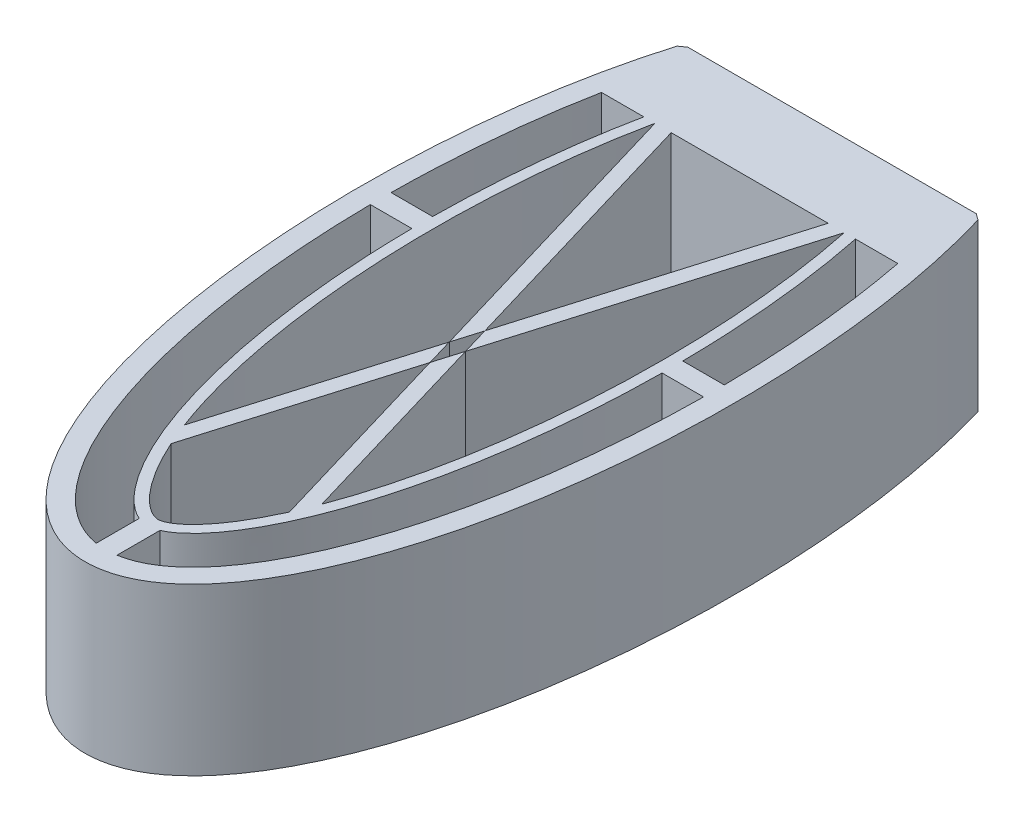
from build123d import *

# Parameters (mm, degrees)
BOSS_EXTRUDE1_DEPTH = 16
BOSS_EXTRUDE2_DEPTH = 16
BOSS_EXTRUDE3_DEPTH = 16
BOSS_EXTRUDE4_DEPTH = 16
SKETCH9_W           = 40
SKETCH9_H           = 24
CUT_EXTRUDE4_DEPTH  = 22
SKETCH10_R          = 1
CUT_EXTRUDE5_DEPTH  = 10
SKETCH25_R          = 1.25
CUT_EXTRUDE12_DEPTH = 4
SKETCH23_R          = 1.25
CUT_EXTRUDE13_DEPTH = 4
SKETCH24_R          = 1.25
CUT_EXTRUDE14_DEPTH = 3


with BuildPart() as part:
    # Sketch1 → Boss-Extrude1 (new body)
    with BuildSketch(Plane(origin=(0, 0, 0), x_dir=(1, 0, 0), z_dir=(0, 1, 0))):
        with BuildLine():
            Line((0, 0), (0, -1.370526213))
            Line((0, -1.370526213), (-4.257744064, -4.437196595))
            add(Edge.make_bspline(
                [(-4.257744064, -4.437196595), (-4.502691757, -5.256633093), (-4.954383697, -6.883392156), (-5.782550999, -10.343670153), (-6.633990879, -14.904009628), (-7.357399252, -20.692157262), (-7.904756341, -28.674189668), (-7.788402639, -38.875434181), (-6.374993684, -50.562842935), (-3.780113753, -60.835361347), (-0.759598491, -67.612587129), (2.128148554, -71.70837272), (4.548190426, -74.065562813), (7.262501719, -75.621626405), (10.25, -76.189186798), (13.237498281, -75.621626405), (15.951809575, -74.065562813), (18.371851447, -71.70837272), (21.259598492, -67.612587128), (24.280113753, -60.835361347), (26.874993684, -50.562842934), (28.28840264, -38.87543418), (28.404756341, -28.674189668), (27.857399252, -20.692157261), (27.133990879, -14.904009627), (26.282550999, -10.343670152), (25.454383697, -6.883392155), (25.002691757, -5.256633093), (24.757744064, -4.437196595)],
                knots=[-2.240685274, -2.240685274, -2.240685274, -2.240685274, -2.17066386, -2.100642445, -1.960599615, -1.820556785, -1.680513956, -1.400428296, -1.120342637, -0.840256978, -0.560171319, -0.420128489, -0.280085659, -0.14004283, 0, 0.14004283, 0.280085659, 0.420128489, 0.560171319, 0.840256978, 1.120342637, 1.400428296, 1.680513956, 1.820556785, 1.960599615, 2.100642445, 2.17066386, 2.240685274, 2.240685274, 2.240685274, 2.240685274], degree=3))
            Line((24.757744064, -4.437196595), (20.5, -1.370526213))
            Line((20.5, -1.370526213), (20.5, 0))
            Line((20.5, 0), (16.5, 0))
            Line((16.5, 0), (16.5, -4))
            Line((16.5, -4), (4, -4))
            Line((4, -4), (4, 0))
            Line((4, 0), (0, 0))
        make_face()
        with BuildLine():
            Line((-2.75, -6.437196595), (23.25, -6.437196595))
            add(Edge.make_bspline(
                [(-2.75, -6.437196595), (-21.25501839, -74), (10.25, -74), (41.75501839, -74), (23.25, -6.437196595)],
                knots=[4.084586939, 4.084586939, 4.084586939, 6.283185307, 6.283185307, 8.481783676, 8.481783676, 8.481783676], degree=2, weights=[1, 0.454220582, 1, 0.454220582, 1]))
        make_face(mode=Mode.SUBTRACT)
    extrude(amount=BOSS_EXTRUDE1_DEPTH)

    # Sketch4 → Boss-Extrude2 (add)
    with BuildSketch(Plane(origin=(0, 16, 0), x_dir=(1, 0, 0), z_dir=(0, 1, 0))):
        with BuildLine():
            Line((24.000704622, -9.437196595), (-3.500704622, -9.437196595))
            add(Edge.make_bspline(
                [(-3.500704622, -9.437196595), (-3.78018184, -10.663685094), (-4.027900282, -11.937196595)],
                knots=[4.169182878, 4.169182878, 4.169182878, 4.236480106, 4.236480106, 4.236480106], degree=2, weights=[1, 0.999433939, 1]))
            Line((-4.027900282, -11.937196595), (-0.970025558, -11.937196595))
            Line((-0.970025558, -11.937196595), (13.964140864, -11.937196595))
            Line((13.964140864, -11.937196595), (15.124869395, -11.937196595))
            Line((15.124869395, -11.937196595), (21.469998047, -11.937196595))
            Line((21.469998047, -11.937196595), (24.527900282, -11.937196595))
            add(Edge.make_bspline(
                [(24.527900282, -11.937196595), (24.28018184, -10.663685094), (24.000704622, -9.437196595)],
                knots=[2.046705202, 2.046705202, 2.046705202, 2.114002429, 2.114002429, 2.114002429], degree=2, weights=[1, 0.999433939, 1]))
        make_face()
    extrude(amount=-BOSS_EXTRUDE2_DEPTH)

    # Sketch5 → Boss-Extrude3 (add)
    with BuildSketch(Plane(origin=(0, 16, 0), x_dir=(1, 0, 0), z_dir=(0, 1, 0))):
        with BuildLine():
            add(Edge.make_bspline(
                [(-1.608424276, -30.437196595), (-1.619611068, -31.103668087), (-1.61967472, -31.770333643), (-1.608424276, -32.437196595)],
                knots=[0.190744117, 0.190744117, 0.190744117, 0.190744117, 0.208396529, 0.208396529, 0.208396529, 0.208396529], degree=3))
            Line((-1.608424276, -30.437196595), (-1.807876391, -30.437196595))
            add(Edge.make_bspline(
                [(-1.807876391, -30.437196595), (-1.813940107, -31.103690976), (-1.813900605, -31.770660251), (-1.807768348, -32.437196595)],
                knots=[0.144049127, 0.144049127, 0.144049127, 0.144049127, 0.154919209, 0.154919209, 0.154919209, 0.154919209], degree=3))
            Line((-1.807768348, -32.437196595), (-1.608424276, -32.437196595))
        make_face()
        with BuildLine():
            Line((-1.807876391, -30.437196595), (-1.608424276, -30.437196595))
            add(Edge.make_bspline(
                [(-1.608424276, -30.437196595), (-1.619611068, -31.103668087), (-1.61967472, -31.770333643), (-1.608424276, -32.437196595)],
                knots=[0.190744117, 0.190744117, 0.190744117, 0.190744117, 0.208396529, 0.208396529, 0.208396529, 0.208396529], degree=3))
            Line((-1.608424276, -32.437196595), (-1.807768348, -32.437196595))
            add(Edge.make_bspline(
                [(-1.807768348, -32.437196595), (-1.789388193, -34.434999523), (-1.716272251, -36.4289131), (-1.343983644, -42.165079283), (-0.898077823, -45.839341341), (0.346876684, -52.659985034), (1.148610045, -55.814277325), (2.539301489, -59.929712099), (3.033767625, -61.19859966), (4.064563561, -63.500134075), (4.601101045, -64.532580437), (5.684075645, -66.332273168), (6.227868525, -67.094482279), (7.280417204, -68.340557688), (7.780467879, -68.814167582), (8.461212451, -69.333011167), (8.674242477, -69.472567343), (9.004847349, -69.659425489), (9.131539116, -69.72194754), (9.25, -69.773015091)],
                knots=[0.154919209, 0.154919209, 0.154919209, 0.154919209, 0.1875, 0.1875, 0.25, 0.25, 0.3125, 0.3125, 0.34375, 0.34375, 0.375, 0.375, 0.40625, 0.40625, 0.4375, 0.4375, 0.453125, 0.453125, 0.46396315, 0.46396315, 0.46396315, 0.46396315], degree=3))
            Line((9.25, -69.773015091), (9.25, -69.717438801))
            add(Edge.make_bspline(
                [(9.25, -69.717438801), (9.315593579, -69.729498649), (9.381443278, -69.740423705), (9.744226149, -69.79399534), (10.049003109, -69.814068253), (10.64971774, -69.803069524), (10.946917103, -69.772686626), (11.244110839, -69.718519431), (11.247055464, -69.717980316), (11.25, -69.717438801)],
                knots=[0.490446512, 0.490446512, 0.490446512, 0.490446512, 0.4921875, 0.4921875, 0.5, 0.5, 0.5078125, 0.5078125, 0.507890684, 0.507890684, 0.507890684, 0.507890684], degree=3))
            Line((11.25, -69.717438801), (11.25, -69.773015091))
            add(Edge.make_bspline(
                [(11.25, -69.773015091), (11.368460884, -69.72194754), (11.495152652, -69.659425489), (11.825757523, -69.472567343), (12.038787549, -69.333011167), (12.719532121, -68.814167582), (13.219582797, -68.340557688), (14.272131475, -67.094482279), (14.815924355, -66.332273168), (15.898898955, -64.532580436), (16.43543644, -63.500134074), (17.466232375, -61.19859966), (17.960698511, -59.929712099), (19.351389955, -55.814277324), (20.153123316, -52.659985033), (21.398077823, -45.839341341), (21.843983644, -42.165079283), (22.216272251, -36.428913099), (22.289388193, -34.434999523), (22.307768348, -32.437196595)],
                knots=[0.53603685, 0.53603685, 0.53603685, 0.53603685, 0.546875, 0.546875, 0.5625, 0.5625, 0.59375, 0.59375, 0.625, 0.625, 0.65625, 0.65625, 0.6875, 0.6875, 0.75, 0.75, 0.8125, 0.8125, 0.845080791, 0.845080791, 0.845080791, 0.845080791], degree=3))
            Line((22.307768348, -32.437196595), (22.108424276, -32.437196595))
            add(Edge.make_bspline(
                [(22.108424276, -32.437196595), (22.119695454, -31.769452391), (22.119650331, -31.102790038), (22.108424276, -30.437196595)],
                knots=[0.791085814, 0.791085814, 0.791085814, 0.791085814, 0.808681538, 0.808681538, 0.808681538, 0.808681538], degree=3))
            Line((22.108424276, -30.437196595), (22.307876391, -30.437196595))
            add(Edge.make_bspline(
                [(22.307876391, -30.437196595), (22.297250113, -29.269207558), (22.26788065, -28.102676939), (22.06166982, -23.135930047), (21.699868558, -19.390973641), (20.945979085, -14.52647439), (20.710270678, -13.21185597), (20.449124772, -11.937196595)],
                knots=[0.855950873, 0.855950873, 0.855950873, 0.855950873, 0.875, 0.875, 0.9375, 0.9375, 0.961484455, 0.961484455, 0.961484455, 0.961484455], degree=3))
            Line((20.449124772, -11.937196595), (19.377002413, -11.937196595))
            add(Edge.make_bspline(
                [(16.867383437, -59.793597718), (17.058943161, -59.287454336), (17.246571447, -58.763158668), (18.337495295, -55.534817861), (19.128163997, -52.42775466), (20.357168692, -45.694494072), (20.798659176, -42.059001665), (21.283154269, -34.593975027), (21.327100461, -30.75510805), (21.014130546, -23.216986247), (20.655798524, -19.510117544), (19.899279436, -14.628650611), (19.651937101, -13.260035708), (19.377002413, -11.937196595)],
                knots=[0.674906638, 0.674906638, 0.674906638, 0.674906638, 0.6875, 0.6875, 0.75, 0.75, 0.8125, 0.8125, 0.875, 0.875, 0.9375, 0.9375, 0.962826996, 0.962826996, 0.962826996, 0.962826996], degree=3))
            add(Edge.make_bspline(
                [(15.956682934, -62), (15.96865042, -61.973462611), (15.980608092, -61.946855666), (16.291176533, -61.253426512), (16.58359423, -60.543431901), (16.867383437, -59.793597718)],
                knots=[0.655503561, 0.655503561, 0.655503561, 0.655503561, 0.65625, 0.65625, 0.674906638, 0.674906638, 0.674906638, 0.674906638], degree=3))
            add(Edge.make_bspline(
                [(4.543317066, -62), (5.032373999, -63.084462839), (5.537820077, -64.052767242), (6.559040753, -65.749836986), (7.071658453, -66.466242071), (8.040895108, -67.613687302), (8.487285543, -68.032676172), (9.062532464, -68.471112536), (9.235821046, -68.583864307), (9.536368312, -68.753733869), (9.663303314, -68.81098681), (9.874020239, -68.889467775), (9.969747255, -68.914904632), (10.132107878, -68.945098766), (10.198533056, -68.95), (10.301466944, -68.95), (10.367892122, -68.945098766), (10.530252745, -68.914904632), (10.625979761, -68.889467775), (10.836696686, -68.81098681), (10.963631688, -68.753733869), (11.264178954, -68.583864307), (11.437467536, -68.471112536), (12.012714457, -68.032676172), (12.459104892, -67.613687302), (13.428341547, -66.466242071), (13.940959248, -65.749836986), (14.962179923, -64.052767242), (15.467626001, -63.084462839), (15.956682934, -62)],
                knots=[0.344496439, 0.344496439, 0.344496439, 0.344496439, 0.375, 0.375, 0.40625, 0.40625, 0.4375, 0.4375, 0.453125, 0.453125, 0.46875, 0.46875, 0.484375, 0.484375, 0.5, 0.5, 0.515625, 0.515625, 0.53125, 0.53125, 0.546875, 0.546875, 0.5625, 0.5625, 0.59375, 0.59375, 0.625, 0.625, 0.655503561, 0.655503561, 0.655503561, 0.655503561], degree=3))
            add(Edge.make_bspline(
                [(3.632616563, -59.793597718), (3.91640577, -60.543431901), (4.208823468, -61.253426512), (4.519391908, -61.946855666), (4.53134958, -61.973462611), (4.543317066, -62)],
                knots=[0.325093362, 0.325093362, 0.325093362, 0.325093362, 0.34375, 0.34375, 0.344496439, 0.344496439, 0.344496439, 0.344496439], degree=3))
            add(Edge.make_bspline(
                [(1.122997587, -11.937196595), (0.848062899, -13.260035708), (0.600720564, -14.628650611), (-0.155798524, -19.510117545), (-0.514130546, -23.216986247), (-0.827100461, -30.755108051), (-0.783154269, -34.593975028), (-0.298659176, -42.059001666), (0.142831308, -45.694494073), (1.371836003, -52.42775466), (2.162504705, -55.534817862), (3.253428553, -58.763158669), (3.441056839, -59.287454336), (3.632616563, -59.793597718)],
                knots=[0.037173004, 0.037173004, 0.037173004, 0.037173004, 0.0625, 0.0625, 0.125, 0.125, 0.1875, 0.1875, 0.25, 0.25, 0.3125, 0.3125, 0.325093362, 0.325093362, 0.325093362, 0.325093362], degree=3))
            Line((1.122997587, -11.937196595), (0.050875228, -11.937196595))
            add(Edge.make_bspline(
                [(0.050875228, -11.937196595), (-0.210270679, -13.21185597), (-0.445979085, -14.526474391), (-1.199868558, -19.390973642), (-1.56166982, -23.135930047), (-1.76788065, -28.10267694), (-1.797250113, -29.269207559), (-1.807876391, -30.437196595)],
                knots=[0.038515545, 0.038515545, 0.038515545, 0.038515545, 0.0625, 0.0625, 0.125, 0.125, 0.144049127, 0.144049127, 0.144049127, 0.144049127], degree=3))
        make_face()
        with BuildLine():
            add(Edge.make_bspline(
                [(-1.807876391, -30.437196595), (-1.813940107, -31.103690976), (-1.813900605, -31.770660251), (-1.807768348, -32.437196595)],
                knots=[0.144049127, 0.144049127, 0.144049127, 0.144049127, 0.154919209, 0.154919209, 0.154919209, 0.154919209], degree=3))
            Line((-1.807876391, -30.437196595), (-5.808424276, -30.437196595))
            add(Edge.make_bspline(
                [(-5.808424276, -30.437196595), (-5.817293432, -31.437196595), (-5.808424276, -32.437196595)],
                knots=[4.688892125, 4.688892125, 4.688892125, 4.735885835, 4.735885835, 4.735885835], degree=2, weights=[1, 0.999723962, 1]))
            Line((-5.808424276, -32.437196595), (-1.807768348, -32.437196595))
        make_face()
        with BuildLine():
            Line((2.687458467, -11.937196595), (1.122997587, -11.937196595))
            Line((1.122997587, -11.937196595), (9.46776956, -40.100304344))
            Line((9.46776956, -40.100304344), (3.632616563, -59.793597718))
            add(Edge.make_bspline(
                [(3.632616563, -59.793597718), (3.91640577, -60.543431901), (4.208823468, -61.253426512), (4.519391908, -61.946855666), (4.53134958, -61.973462611), (4.543317066, -62)],
                knots=[0.325093362, 0.325093362, 0.325093362, 0.325093362, 0.34375, 0.34375, 0.344496439, 0.344496439, 0.344496439, 0.344496439], degree=3))
            Line((4.543317066, -62), (10.25, -42.740285429))
            Line((10.25, -42.740285429), (15.956682934, -62))
            add(Edge.make_bspline(
                [(15.956682934, -62), (15.96865042, -61.973462611), (15.980608092, -61.946855666), (16.291176533, -61.253426512), (16.58359423, -60.543431901), (16.867383437, -59.793597718)],
                knots=[0.655503561, 0.655503561, 0.655503561, 0.655503561, 0.65625, 0.65625, 0.674906638, 0.674906638, 0.674906638, 0.674906638], degree=3))
            Line((16.867383437, -59.793597718), (11.03223044, -40.100304344))
            Line((11.03223044, -40.100304344), (19.377002413, -11.937196595))
            Line((19.377002413, -11.937196595), (17.812541533, -11.937196595))
            Line((17.812541533, -11.937196595), (10.25, -37.460323259))
            Line((10.25, -37.460323259), (2.687458467, -11.937196595))
        make_face()
        with BuildLine():
            add(Edge.make_bspline(
                [(9.25, -69.773015091), (9.302320225, -69.795569926), (9.353034857, -69.815890338), (9.56261905, -69.89394942), (9.7165513, -69.935820516), (10.001350762, -69.988784548), (10.132040587, -70), (10.367959413, -70), (10.498649238, -69.988784548), (10.7834487, -69.935820516), (10.93738095, -69.89394942), (11.146965144, -69.815890338), (11.197679775, -69.795569926), (11.25, -69.773015091)],
                knots=[0.46396315, 0.46396315, 0.46396315, 0.46396315, 0.46875, 0.46875, 0.484375, 0.484375, 0.5, 0.5, 0.515625, 0.515625, 0.53125, 0.53125, 0.53603685, 0.53603685, 0.53603685, 0.53603685], degree=3))
            Line((9.25, -69.773015091), (9.25, -73.917438801))
            add(Edge.make_bspline(
                [(9.25, -73.917438801), (10.25, -74.082721658), (11.25, -73.917438801)],
                knots=[6.220889602, 6.220889602, 6.220889602, 6.345481013, 6.345481013, 6.345481013], degree=2, weights=[1, 0.99806025, 1]))
            Line((11.25, -73.917438801), (11.25, -69.773015091))
        make_face()
        with BuildLine():
            Line((9.25, -69.717438801), (9.25, -69.773015091))
            add(Edge.make_bspline(
                [(9.25, -69.773015091), (9.302320225, -69.795569926), (9.353034857, -69.815890338), (9.56261905, -69.89394942), (9.7165513, -69.935820516), (10.001350762, -69.988784548), (10.132040587, -70), (10.367959413, -70), (10.498649238, -69.988784548), (10.7834487, -69.935820516), (10.93738095, -69.89394942), (11.146965144, -69.815890338), (11.197679775, -69.795569926), (11.25, -69.773015091)],
                knots=[0.46396315, 0.46396315, 0.46396315, 0.46396315, 0.46875, 0.46875, 0.484375, 0.484375, 0.5, 0.5, 0.515625, 0.515625, 0.53125, 0.53125, 0.53603685, 0.53603685, 0.53603685, 0.53603685], degree=3))
            Line((11.25, -69.773015091), (11.25, -69.717438801))
            add(Edge.make_bspline(
                [(9.25, -69.717438801), (9.315593579, -69.729498649), (9.381443278, -69.740423705), (9.744226149, -69.79399534), (10.049003109, -69.814068253), (10.64971774, -69.803069524), (10.946917103, -69.772686626), (11.244110839, -69.718519431), (11.247055464, -69.717980316), (11.25, -69.717438801)],
                knots=[0.490446512, 0.490446512, 0.490446512, 0.490446512, 0.4921875, 0.4921875, 0.5, 0.5, 0.5078125, 0.5078125, 0.507890684, 0.507890684, 0.507890684, 0.507890684], degree=3))
        make_face()
        with BuildLine():
            add(Edge.make_bspline(
                [(22.307768348, -32.437196595), (22.313900605, -31.770660251), (22.313940107, -31.103690976), (22.307876391, -30.437196595)],
                knots=[0.845080791, 0.845080791, 0.845080791, 0.845080791, 0.855950873, 0.855950873, 0.855950873, 0.855950873], degree=3))
            Line((22.307768348, -32.437196595), (26.308424276, -32.437196595))
            add(Edge.make_bspline(
                [(26.308424276, -32.437196595), (26.317293432, -31.437196595), (26.308424276, -30.437196595)],
                knots=[7.791293784, 7.791293784, 7.791293784, 7.835892212, 7.835892212, 7.835892212], degree=2, weights=[0.764849854, 0.768966994, 0.773533288]))
            Line((26.308424276, -30.437196595), (22.307876391, -30.437196595))
        make_face()
        with BuildLine():
            Line((22.108424276, -32.437196595), (22.307768348, -32.437196595))
            add(Edge.make_bspline(
                [(22.307768348, -32.437196595), (22.313900605, -31.770660251), (22.313940107, -31.103690976), (22.307876391, -30.437196595)],
                knots=[0.845080791, 0.845080791, 0.845080791, 0.845080791, 0.855950873, 0.855950873, 0.855950873, 0.855950873], degree=3))
            Line((22.307876391, -30.437196595), (22.108424276, -30.437196595))
            add(Edge.make_bspline(
                [(22.108424276, -32.437196595), (22.119695454, -31.769452391), (22.119650331, -31.102790038), (22.108424276, -30.437196595)],
                knots=[0.791085814, 0.791085814, 0.791085814, 0.791085814, 0.808681538, 0.808681538, 0.808681538, 0.808681538], degree=3))
        make_face()
    extrude(amount=-BOSS_EXTRUDE3_DEPTH)

    # Sketch7 → Boss-Extrude4 (add)
    with BuildSketch(Plane(origin=(0, 16, 0), x_dir=(1, 0, 0), z_dir=(0, 1, 0))):
        with BuildLine():
            Line((-2.75, -6.437196595), (23.25, -6.437196595))
            add(Edge.make_bspline(
                [(24.000704622, -9.437196595), (23.649310969, -7.895102117), (23.25, -6.437196595)],
                knots=[2.114002429, 2.114002429, 2.114002429, 2.198598368, 2.198598368, 2.198598368], degree=2, weights=[1, 0.999105574, 1]))
            Line((24.000704622, -9.437196595), (-3.500704622, -9.437196595))
            add(Edge.make_bspline(
                [(-2.75, -6.437196595), (-3.149310969, -7.895102117), (-3.500704622, -9.437196595)],
                knots=[4.084586939, 4.084586939, 4.084586939, 4.169182878, 4.169182878, 4.169182878], degree=2, weights=[1, 0.999105574, 1]))
        make_face()
    extrude(amount=-BOSS_EXTRUDE4_DEPTH)

    # Sketch9 → Cut-Extrude4 (cut)
    with BuildSketch(Plane(origin=(0, 16, 0), x_dir=(1, 0, 0), z_dir=(0, 1, 0))):
        with Locations((12, 8)):
            Rectangle(SKETCH9_W, SKETCH9_H)
    extrude(amount=-CUT_EXTRUDE4_DEPTH, mode=Mode.SUBTRACT)

    # Sketch10 → Cut-Extrude5 (cut)
    with BuildSketch(Plane(origin=(0, 0, 4), x_dir=(-1, 0, 0), z_dir=(0, 0, -1))):
        with Locations((-22.5, 8)):
            Circle(SKETCH10_R)
        with Locations((2, 8)):
            Circle(SKETCH10_R)
    extrude(amount=-CUT_EXTRUDE5_DEPTH, mode=Mode.SUBTRACT)

    # Sketch25 → Cut-Extrude12 (cut)
    with BuildSketch(Plane(origin=(0, 0, 30.437196595), x_dir=(-1, 0, 0), z_dir=(0, 0, -1))):
        with Locations((-24.308150334, 8)):
            Circle(SKETCH25_R)
    extrude(amount=-CUT_EXTRUDE12_DEPTH, mode=Mode.SUBTRACT)

    # Sketch23 → Cut-Extrude13 (cut)
    with BuildSketch(Plane(origin=(0, 0, 30.437196595), x_dir=(-1, 0, 0), z_dir=(0, 0, -1))):
        with Locations((3.808150334, 8)):
            Circle(SKETCH23_R)
    extrude(amount=-CUT_EXTRUDE13_DEPTH, mode=Mode.SUBTRACT)

    # Sketch24 → Cut-Extrude14 (cut)
    with BuildSketch(Plane.ZY.offset(-9.25)):
        with Locations((71.845226945, 8)):
            Circle(SKETCH24_R)
    extrude(amount=-CUT_EXTRUDE14_DEPTH, mode=Mode.SUBTRACT)


solid = part.part
